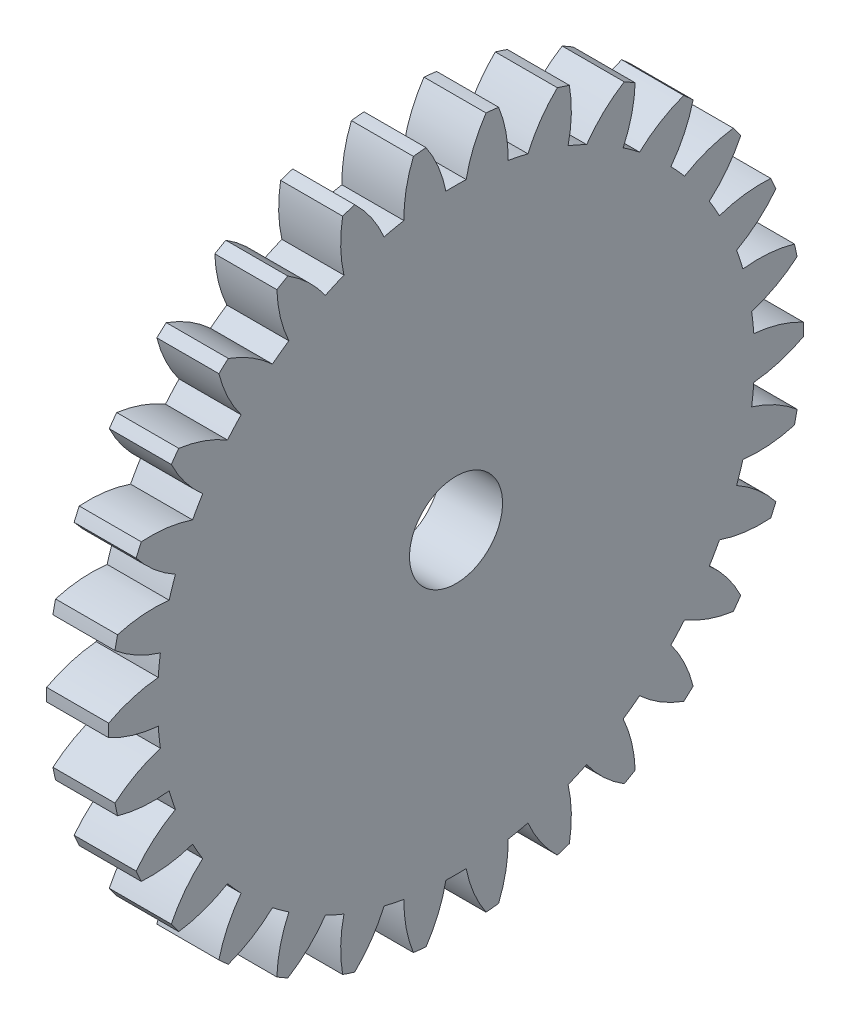
from build123d import *

# Parameters (mm, degrees)
BASPROSKE_W     = 2
BASPROSKE_H     = 11.2
TOOTHCUT_DEPTH  = 16.964961635
TEETHCUTS_COUNT = 30
TEETHCUTS_ANGLE = 348
BORSKE_R        = 1.5
BORE_DEPTH      = 50.0000508


with BuildPart() as part:
    # BasProSke → Base-Revolve (revolve)
    with BuildSketch(Plane(origin=(0, 0, 0), x_dir=(1, 0, 0), z_dir=(0, 1, 0)), mode=Mode.PRIVATE) as base_revolve_sk:
        with Locations((1, 5.6)):
            Rectangle(BASPROSKE_W, BASPROSKE_H)
    revolve(base_revolve_sk.sketch.rotate(Axis((-10, 0, 0), (1, 0, 0)), 180), axis=Axis((-10, 0, 0), (1, 0, 0)))

    # TooCutSke → ToothCut (cut, through all)
    with BuildSketch(Plane(origin=(0, 0, 0), x_dir=(0, 0, -1), z_dir=(1, 0, 0))):
        with BuildLine():
            ThreePointArc((0.327063784, 9.618440897), (0, 9.624), (-0.327063784, 9.618440897))
            ThreePointArc((-0.327063784, 9.618440897), (-0.575727667, 10.433821081), (-0.983909228, 11.182196913))
            ThreePointArc((-0.983909228, 11.182196913), (0, 11.2254), (0.983909228, 11.182196913))
            ThreePointArc((0.983909228, 11.182196913), (0.575727667, 10.433821081), (0.327063784, 9.618440897))
        make_face()
    toothcut = extrude(amount=TOOTHCUT_DEPTH, mode=Mode.SUBTRACT)

    # TeethCuts: ToothCut ×30 about axis
    teethcuts_axis = Axis((-10, 0, 0), (1, 0, 0))
    for i in range(1, TEETHCUTS_COUNT):
        add(toothcut.rotate(teethcuts_axis, i * TEETHCUTS_ANGLE / (TEETHCUTS_COUNT - 1)), mode=Mode.SUBTRACT)

    # BorSke → Bore (cut, symmetric)
    with BuildSketch(Plane(origin=(0, 0, 0), x_dir=(0, 0, -1), z_dir=(1, 0, 0))):
        with Locations(Location((0, 0, 0), (0, 0, 180))):
            Circle(BORSKE_R)
    extrude(amount=BORE_DEPTH, both=True, mode=Mode.SUBTRACT)


solid = part.part
